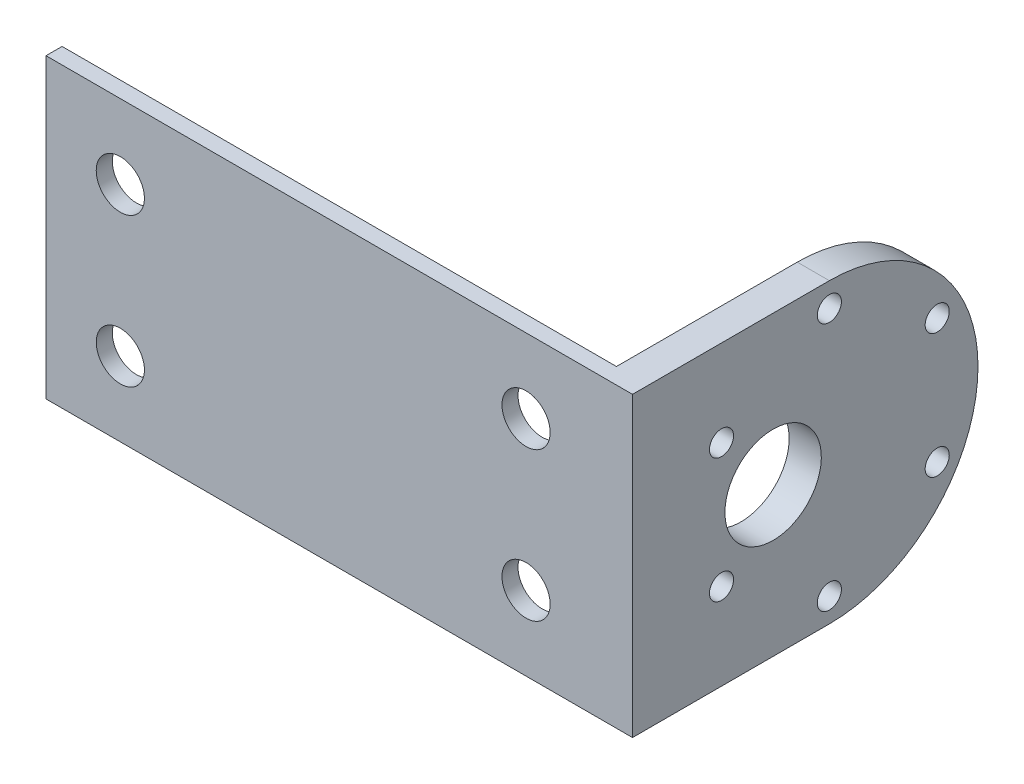
from build123d import *

# Parameters (mm, degrees)
SKETCH_2_W      = 69
SKETCH_2_H      = 37
SKETCH_2_R      = 3
EXTRUDE_1_DEPTH = 2
SKETCH_3_W      = 2
SKETCH_3_H      = 37
SKETCH_3_R      = 1.5
SKETCH_3_R_2    = 6
EXTRUDE_2_DEPTH = 4


with BuildPart() as part:
    # 草图2 → 凸台-拉伸1 (new body)
    with BuildSketch(Plane.XY):
        Rectangle(SKETCH_2_W, SKETCH_2_H)
        with Locations((25.25, 9.25)):
            Circle(SKETCH_2_R, mode=Mode.SUBTRACT)
        with Locations(Location((25.25, -9.25, 0), (0, 0, 180))):
            Circle(SKETCH_2_R, mode=Mode.SUBTRACT)
        with Locations(Location((-25.25, 9.25, 0), (0, 0, 180))):
            Circle(SKETCH_2_R, mode=Mode.SUBTRACT)
        with Locations((-25.25, -9.25)):
            Circle(SKETCH_2_R, mode=Mode.SUBTRACT)
    extrude(amount=EXTRUDE_1_DEPTH)

    # 草图3 → 凸台-拉伸2 (add)
    # profile 1 of 3: a face of its own
    with BuildSketch(Plane(origin=(34.5, 0, 0), x_dir=(0, 0, -1), z_dir=(1, 0, 0))):
        with BuildLine():
            ThreePointArc((22.5, -18.5), (4, 0), (22.5, 18.5))
            Line((22.5, 18.5), (0, 18.5))
            Line((0, 18.5), (0, -18.5))
            Line((0, -18.5), (22.5, -18.5))
        make_face()
    # profile 2 of 3: a face of its own
    with BuildSketch(Plane(origin=(34.5, 0, 0), x_dir=(0, 0, -1), z_dir=(1, 0, 0))):
        with Locations((-1, 0)):
            Rectangle(SKETCH_3_W, SKETCH_3_H)
    # profile 3 of 3: a face of its own
    with BuildSketch(Plane(origin=(34.5, 0, 0), x_dir=(0, 0, -1), z_dir=(1, 0, 0))):
        with BuildLine():
            ThreePointArc((41, 0), (35.581475452, 13.081475452), (22.5, 18.5))
            ThreePointArc((22.5, 18.5), (4, 0), (22.5, -18.5))
            ThreePointArc((22.5, -18.5), (35.581475452, -13.081475452), (41, 0))
        make_face()
        with Locations(Location((9.076606241, -7.75, 0), (0, 0, 90))):
            Circle(SKETCH_3_R, mode=Mode.SUBTRACT)
        with Locations(Location((22.5, -15.5, 0), (0, 0, 90))):
            Circle(SKETCH_3_R, mode=Mode.SUBTRACT)
        with Locations(Location((35.923393759, -7.75, 0), (0, 0, 90))):
            Circle(SKETCH_3_R, mode=Mode.SUBTRACT)
        with Locations(Location((15.5, 0, 0), (0, 0, 90))):
            Circle(SKETCH_3_R_2, mode=Mode.SUBTRACT)
        with Locations(Location((9.076606241, 7.75, 0), (0, 0, 90))):
            Circle(SKETCH_3_R, mode=Mode.SUBTRACT)
        with Locations(Location((35.923393759, 7.75, 0), (0, 0, 90))):
            Circle(SKETCH_3_R, mode=Mode.SUBTRACT)
        with Locations(Location((22.5, 15.5, 0), (0, 0, 90))):
            Circle(SKETCH_3_R, mode=Mode.SUBTRACT)
    extrude(amount=EXTRUDE_2_DEPTH)


solid = part.part
